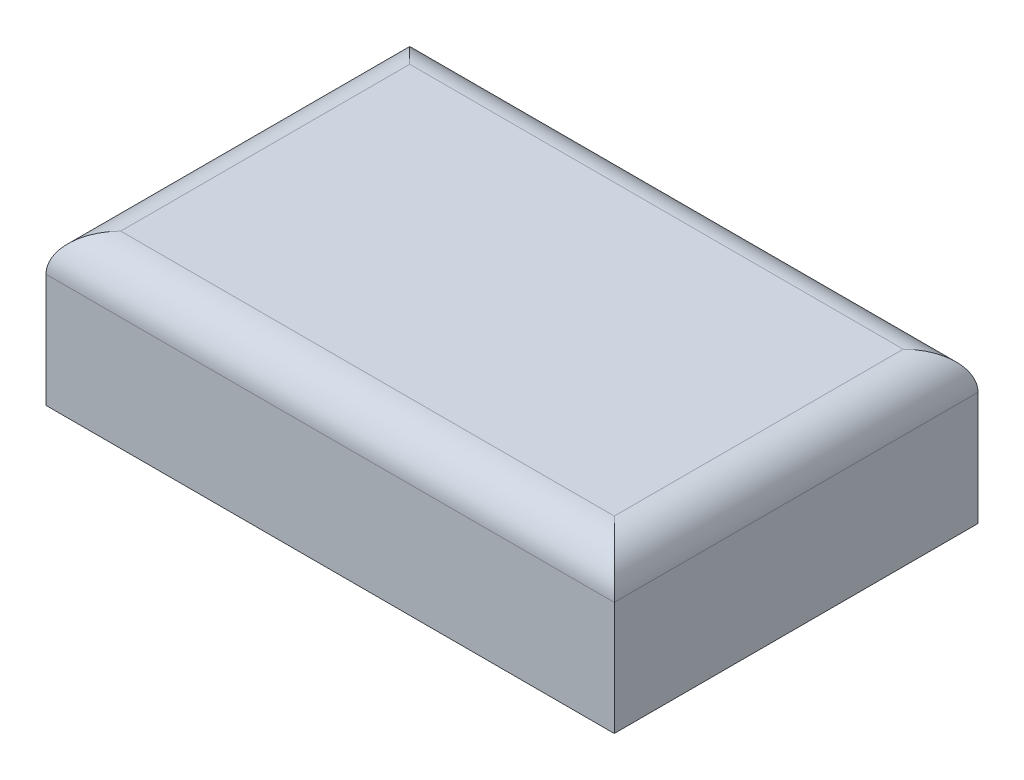
from build123d import *

# Parameters (mm, degrees)
SKETCH1_W           = 76.04
SKETCH1_H           = 48.67
BOSS_EXTRUDE1_DEPTH = 20.2
FILLET3_R           = 5


with BuildPart() as part:
    # Sketch1 → Boss-Extrude1 (new body)
    with BuildSketch(Plane(origin=(0, 0, 0), x_dir=(1, 0, 0), z_dir=(0, 1, 0))):
        with Locations((-30.185186327, -12.098345934)):
            Rectangle(SKETCH1_W, SKETCH1_H)
    extrude(amount=BOSS_EXTRUDE1_DEPTH)

    # Fillet3
    fillet3_edges = [part.edges().sort_by_distance(p)[0] for p in [
        (-30.185186327, 20.2, -12.236654066),
        (-68.205186327, 20.2, 12.098345934),
        (-30.185186327, 20.2, 36.433345934),
        (7.834813673, 20.2, 12.098345934),
    ]]
    fillet(fillet3_edges, radius=FILLET3_R)


solid = part.part
